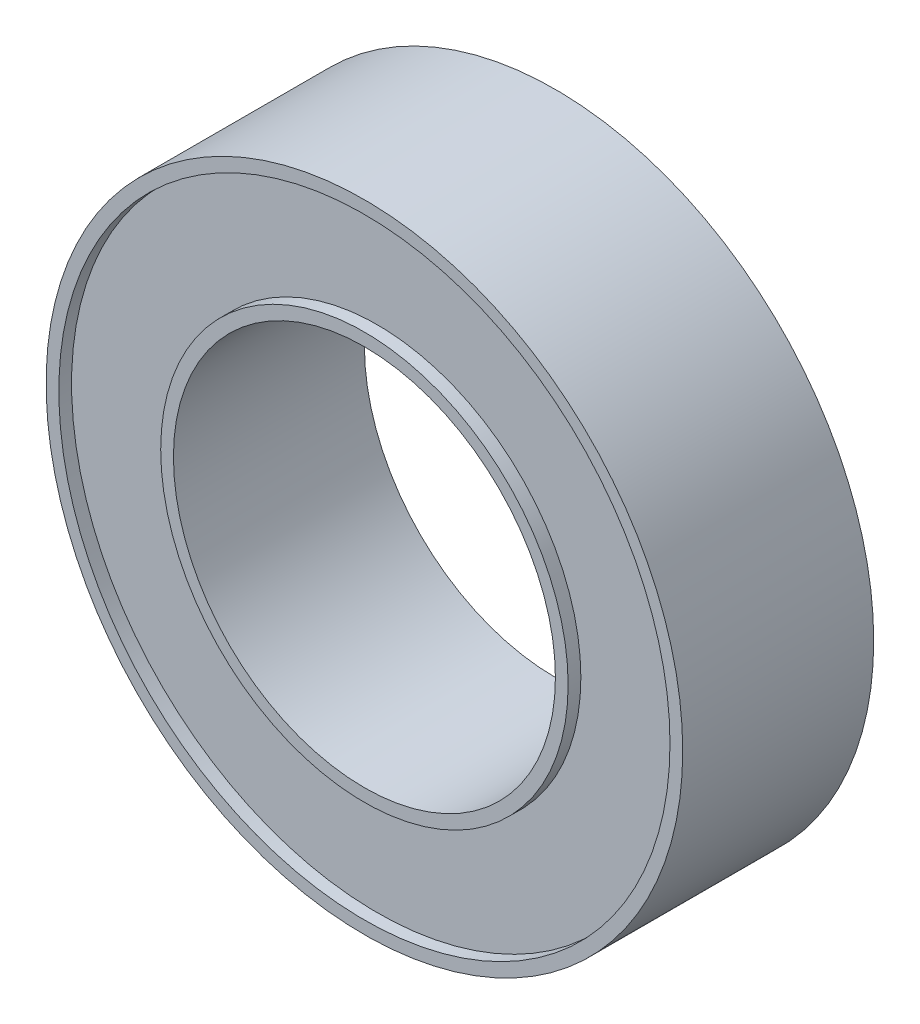
from build123d import *

# Parameters (mm, degrees)
EXTRUDE_1_DEPTH      = 1.5
EXTRUDE_1_DEPTH_BACK = 1.5
SKETCH_1_R           = 5
SKETCH_1_R_2         = 3
SKETCH_2_R           = 4.8
SKETCH_2_R_2         = 3.2
CUT_EXTRUDE_1_DEPTH  = 0.2


with BuildPart() as part:
    # 草图1 → 凸台-拉伸1 (new, two sides: drawn at the far end of the back side and taken through both)
    with BuildSketch(Plane.XY.offset(-EXTRUDE_1_DEPTH_BACK)):
        Circle(SKETCH_1_R)
        Circle(SKETCH_1_R_2, mode=Mode.SUBTRACT)
    extrude(amount=EXTRUDE_1_DEPTH + EXTRUDE_1_DEPTH_BACK)

    # 草图2 → 切除-拉伸1 (cut)
    with BuildSketch(Plane.XY.offset(1.5)):
        Circle(SKETCH_2_R)
        Circle(SKETCH_2_R_2, mode=Mode.SUBTRACT)
    cut_extrude_1 = extrude(amount=-CUT_EXTRUDE_1_DEPTH, mode=Mode.SUBTRACT)

    # 镜向1: 切除-拉伸1 across plane
    add(cut_extrude_1.mirror(Plane.XY), mode=Mode.SUBTRACT)


solid = part.part
